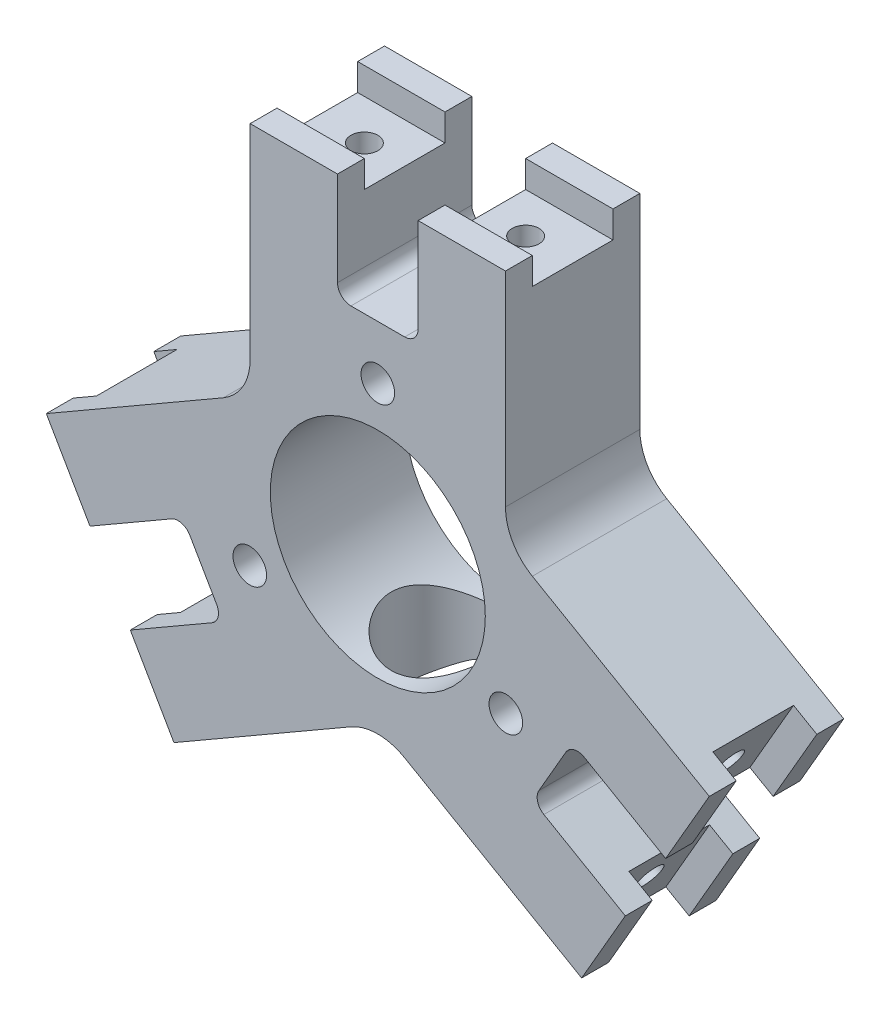
from build123d import *

# Parameters (mm, degrees)
BOSS_EXTRU_1_DEPTH           = 5
BOSS_EXTRU_1_DEPTH_BACK      = 5
ESQUISSE1_R                  = 8
ESQUISSE1_R_2                = 1.25
ESQUISSE2_W                  = 6
ESQUISSE2_H                  = 2
ENL_V_MAT_EXTRU_1_DEPTH      = 19
ESQUISSE3_R                  = 1
ENL_V_MAT_EXTRU_2_DEPTH      = 5
R_P_TITION_CIRCULAIRE1_COUNT = 3
ESQUISSE5_R                  = 4
ENL_V_MAT_EXTRU_5_DEPTH      = 18


with BuildPart() as part:
    # Esquisse1 → Boss.-Extru.1 (new, two sides: drawn at the far end of the back side and taken through both)
    with BuildSketch(Plane.XY.offset(-BOSS_EXTRU_1_DEPTH_BACK)):
        with BuildLine():
            Line((24.668584287, -3.272758664), (21.418584287, -8.901923789))
            Line((21.418584287, -8.901923789), (15.356406461, -5.401923789))
            ThreePointArc((15.356406461, -5.401923789), (14.597587415, -5.302023366), (13.990381057, -5.767949192))
            Line((13.990381057, -5.767949192), (11.990381057, -9.232050808))
            ThreePointArc((11.990381057, -9.232050808), (11.890480634, -9.990869853), (12.356406461, -10.598076211))
            Line((12.356406461, -10.598076211), (18.418584287, -14.098076211))
            Line((18.418584287, -14.098076211), (15.168584287, -19.727241336))
            Line((15.168584287, -19.727241336), (2, -12.124355653))
            ThreePointArc((2, -12.124355653), (0, -11.588457268), (-2, -12.124355653))
            Line((-2, -12.124355653), (-15.168584287, -19.727241336))
            Line((-15.168584287, -19.727241336), (-18.418584287, -14.098076211))
            Line((-18.418584287, -14.098076211), (-12.356406461, -10.598076211))
            ThreePointArc((-12.356406461, -10.598076211), (-11.890480634, -9.990869853), (-11.990381057, -9.232050808))
            Line((-11.990381057, -9.232050808), (-13.990381057, -5.767949192))
            ThreePointArc((-13.990381057, -5.767949192), (-14.597587415, -5.302023366), (-15.356406461, -5.401923789))
            Line((-15.356406461, -5.401923789), (-21.418584287, -8.901923789))
            Line((-21.418584287, -8.901923789), (-24.668584287, -3.272758664))
            Line((-24.668584287, -3.272758664), (-11.5, 4.330127019))
            ThreePointArc((-11.5, 4.330127019), (-10.035898385, 5.794228634), (-9.5, 7.794228634))
            Line((-9.5, 7.794228634), (-9.5, 23))
            Line((-9.5, 23), (-3, 23))
            Line((-3, 23), (-3, 16))
            ThreePointArc((-3, 16), (-2.707106781, 15.292893219), (-2, 15))
            Line((-2, 15), (2, 15))
            ThreePointArc((2, 15), (2.707106781, 15.292893219), (3, 16))
            Line((3, 16), (3, 23))
            Line((3, 23), (9.5, 23))
            Line((9.5, 23), (9.5, 7.794228634))
            ThreePointArc((9.5, 7.794228634), (10.035898385, 5.794228634), (11.5, 4.330127019))
            Line((11.5, 4.330127019), (24.668584287, -3.272758664))
        make_face()
        Circle(ESQUISSE1_R, mode=Mode.SUBTRACT)
        with Locations((0, 11)):
            Circle(ESQUISSE1_R_2, mode=Mode.SUBTRACT)
        with Locations((9.526279442, -5.5)):
            Circle(ESQUISSE1_R_2, mode=Mode.SUBTRACT)
        with Locations((-9.526279442, -5.5)):
            Circle(ESQUISSE1_R_2, mode=Mode.SUBTRACT)
    extrude(amount=BOSS_EXTRU_1_DEPTH + BOSS_EXTRU_1_DEPTH_BACK)

    # Esquisse2 → Enlèv. mat.-Extru.1 (cut)
    with BuildSketch(Plane.ZY.offset(9.5)):
        with Locations((0, 22)):
            Rectangle(ESQUISSE2_W, ESQUISSE2_H)
    enl_v_mat_extru_1 = extrude(amount=-ENL_V_MAT_EXTRU_1_DEPTH, mode=Mode.SUBTRACT)

    # Esquisse3 → Enlèv. mat.-Extru.2 (cut)
    with BuildSketch(Plane(origin=(0, 21, 0), x_dir=(1, 0, 0), z_dir=(0, 1, 0))):
        with Locations(Location((-6, 0, 0), (0, 0, 270))):
            Circle(ESQUISSE3_R)
        with Locations(Location((6, 0, 0), (0, 0, 270))):
            Circle(ESQUISSE3_R)
    enl_v_mat_extru_2 = extrude(amount=-ENL_V_MAT_EXTRU_2_DEPTH, mode=Mode.SUBTRACT)

    # Répétition circulaire1: Enlèv. mat.-Extru.1, Enlèv. mat.-Extru.2 ×3 about axis
    r_p_tition_circulaire1_axis = Axis((0, 0, 0), (0, 0, 1))
    add([enl_v_mat_extru_1.rotate(r_p_tition_circulaire1_axis, i * 360 / R_P_TITION_CIRCULAIRE1_COUNT) for i in range(1, R_P_TITION_CIRCULAIRE1_COUNT)], mode=Mode.SUBTRACT)
    add([enl_v_mat_extru_2.rotate(r_p_tition_circulaire1_axis, i * 360 / R_P_TITION_CIRCULAIRE1_COUNT) for i in range(1, R_P_TITION_CIRCULAIRE1_COUNT)], mode=Mode.SUBTRACT)

    # Esquisse5 → Enlèv. mat.-Extru.5 (cut)
    with BuildSketch(Plane(origin=(0, 0, 0), x_dir=(1, 0, 0), z_dir=(0, 1, 0))):
        with Locations(Location((0, 0, 0), (0, 0, 270))):
            Circle(ESQUISSE5_R)
    extrude(amount=-ENL_V_MAT_EXTRU_5_DEPTH, mode=Mode.SUBTRACT)


solid = part.part
